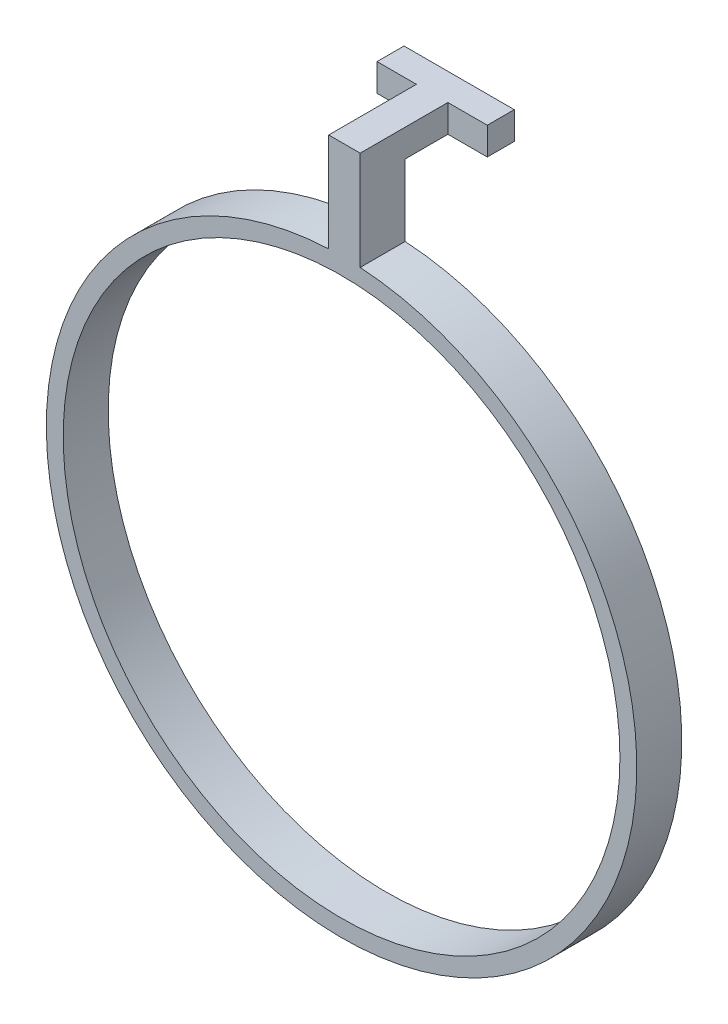
from build123d import *

# Parameters (mm, degrees)
SKETCH2_R           = 24.75
BOSS_EXTRUDE1_DEPTH = 4
SKETCH3_W           = 2.8
SKETCH3_H           = 2.45
BOSS_EXTRUDE2_DEPTH = 3.8
BOSS_EXTRUDE3_START = -6.3
SKETCH4_W           = 2.4
SKETCH4_H           = 2.45
BOSS_EXTRUDE3_DEPTH = 9.8


with BuildPart() as part:
    # Sketch2 → Boss-Extrude1 (new body)
    with BuildSketch(Plane.XY):
        with BuildLine():
            Line((-1.144859813, 35), (1.655140187, 35))
            Line((1.655140187, 35), (1.655140187, 26.19776729))
            ThreePointArc((1.655140187, 26.19776729), (-0.255503863, -26.2487565), (-1.144859813, 26.225022326))
            Line((-1.144859813, 26.225022326), (-1.144859813, 35))
        make_face()
        Circle(SKETCH2_R, mode=Mode.SUBTRACT)
    extrude(amount=BOSS_EXTRUDE1_DEPTH)

    # Sketch3 → Boss-Extrude2 (add)
    with BuildSketch(Plane(origin=(0, 0, 0), x_dir=(-1, 0, 0), z_dir=(0, 0, -1))):
        with Locations((-0.255140187, 33.775)):
            Rectangle(SKETCH3_W, SKETCH3_H)
    extrude(amount=BOSS_EXTRUDE2_DEPTH)

    # Sketch4 → Boss-Extrude3 (add)
    with BuildSketch(Plane(origin=(1.655140187, 0, 0), x_dir=(0, 0, -1), z_dir=(1, 0, 0)).offset(BOSS_EXTRUDE3_START)):
        with Locations((5, 33.775)):
            Rectangle(SKETCH4_W, SKETCH4_H)
    extrude(amount=BOSS_EXTRUDE3_DEPTH)


solid = part.part
